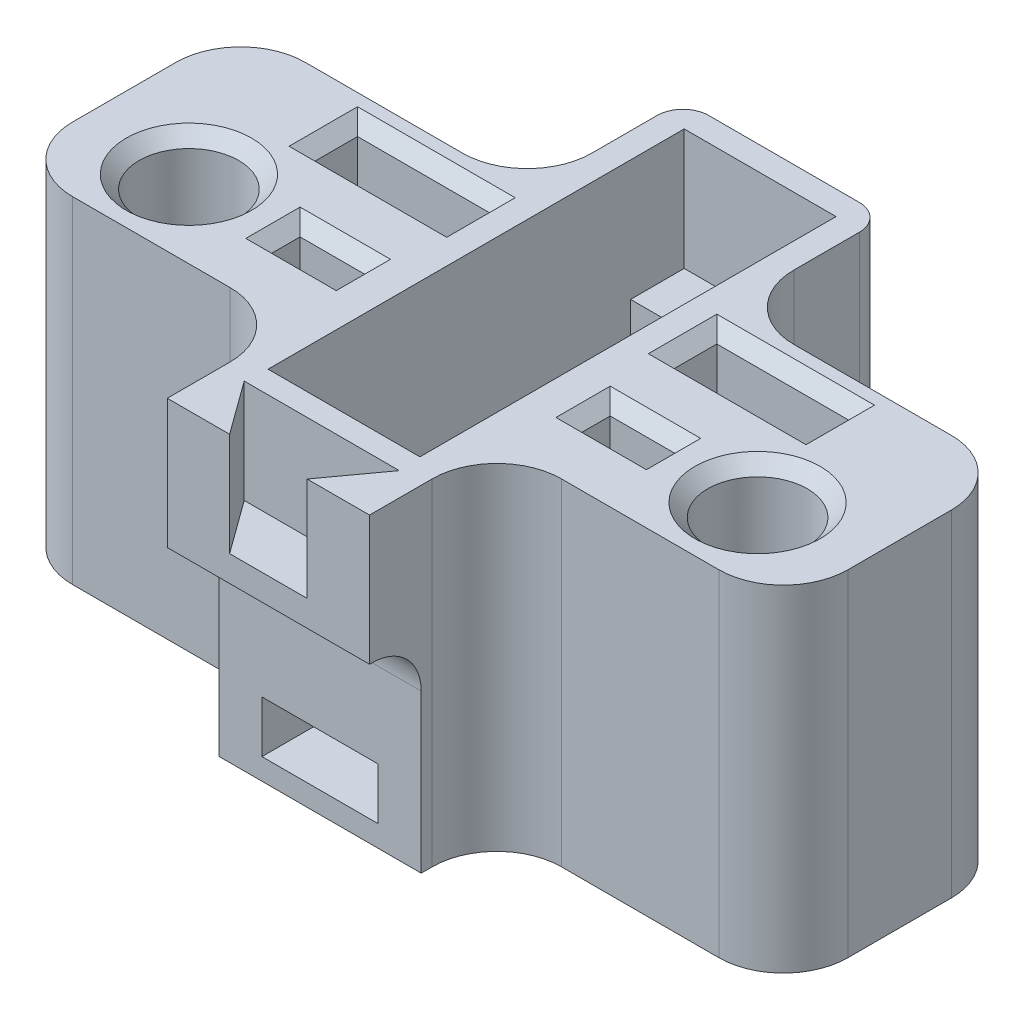
from build123d import *

# Parameters (mm, degrees)
SKETCH1_W             = 60
SKETCH1_H             = 18
BOSS_EXTRUDE1_DEPTH   = 26
SKETCH2_R             = 3.85
EYESHAFT_HOLES_DEPTH  = 15
EYESHAFT_FILLET_R     = 3
SKETCH5_W             = 5
SKETCH5_H             = 2.2
FRONT_LEG_HOLES_DEPTH = 13
SKETCH7_W             = 10.2
SKETCH7_H             = 3.3
BACK_LEGS_DEPTH       = 13
SKETCH18_W            = 15.65
SKETCH18_H            = 35.9
SERVO_BLOCK_DEPTH     = 26
SKETCH19_W            = 11.75
SKETCH19_H            = 32.2
SERVO_ARMS_DEPTH      = 9.35
SKETCH20_W            = 11.75
SKETCH20_H            = 23.9
CUT_EXTRUDE10_DEPTH   = 15
FILLET4_R             = 5
CHAMFER1_SIZE         = 1
SKETCH21_W            = 9
SKETCH21_H            = 4
CUT_EXTRUDE11_DEPTH   = 15
FILLET5_R             = 3
SKETCH22_R            = 0.75
CUT_EXTRUDE12_DEPTH   = 3
FILLET6_R             = 5
SKETCH23_W            = 15.65
SKETCH23_H            = 10
BOSS_EXTRUDE3_DEPTH   = 4
DOVE_TAIL_DEPTH       = 8
FILLET8_R             = 3.8
FILLET9_R             = 2


with BuildPart() as part:
    # Sketch1 → Boss-Extrude1 (new body)
    with BuildSketch(Plane(origin=(0, 0, 0), x_dir=(1, 0, 0), z_dir=(0, 1, 0))):
        Rectangle(SKETCH1_W, SKETCH1_H)
    extrude(amount=BOSS_EXTRUDE1_DEPTH)

    # Sketch2 → Eyeshaft holes (cut)
    with BuildSketch(Plane(origin=(0, 26, 0), x_dir=(1, 0, 0), z_dir=(0, 1, 0))):
        with Locations(Location((-22, -3, 0), (0, 0, 270))):
            Circle(SKETCH2_R)
        with Locations(Location((22, -3, 0), (0, 0, 270))):
            Circle(SKETCH2_R)
    extrude(amount=-EYESHAFT_HOLES_DEPTH, mode=Mode.SUBTRACT)

    # Eyeshaft Fillet
    eyeshaft_fillet_edges = [part.edges().sort_by_distance(p)[0] for p in [
        (-22, 11, -0.85),
        (22, 11, -0.85),
    ]]
    fillet(eyeshaft_fillet_edges, radius=EYESHAFT_FILLET_R)

    # Sketch5 → Front leg holes (cut)
    with BuildSketch(Plane(origin=(0, 26, 0), x_dir=(1, 0, 0), z_dir=(0, 1, 0))):
        with Locations((-12, -3)):
            Rectangle(SKETCH5_W, SKETCH5_H)
        with Locations((12, -3)):
            Rectangle(SKETCH5_W, SKETCH5_H)
    extrude(amount=-FRONT_LEG_HOLES_DEPTH, mode=Mode.SUBTRACT)

    # Sketch7 → Back Legs (cut)
    with BuildSketch(Plane(origin=(0, 26, 0), x_dir=(1, 0, 0), z_dir=(0, 1, 0))):
        with Locations((-13.9, 5.4)):
            Rectangle(SKETCH7_W, SKETCH7_H)
        with Locations((13.9, 5.4)):
            Rectangle(SKETCH7_W, SKETCH7_H)
    extrude(amount=-BACK_LEGS_DEPTH, mode=Mode.SUBTRACT)

    # Sketch18 → Servo Block (add)
    with BuildSketch(Plane(origin=(0, 26, 0), x_dir=(1, 0, 0), z_dir=(0, 1, 0))):
        with Locations((0, 3.1)):
            Rectangle(SKETCH18_W, SKETCH18_H)
    extrude(amount=-SERVO_BLOCK_DEPTH)

    # Sketch19 → Servo Arms (cut)
    with BuildSketch(Plane(origin=(0, 26, 0), x_dir=(1, 0, 0), z_dir=(0, 1, 0))):
        with Locations((0, 3.1)):
            Rectangle(SKETCH19_W, SKETCH19_H)
    extrude(amount=-SERVO_ARMS_DEPTH, mode=Mode.SUBTRACT)

    # Sketch20 → Cut-Extrude10 (cut)
    with BuildSketch(Plane(origin=(0, 16.65, 0), x_dir=(1, 0, 0), z_dir=(0, 1, 0))):
        with Locations((0, 3.1)):
            Rectangle(SKETCH20_W, SKETCH20_H)
    extrude(amount=-CUT_EXTRUDE10_DEPTH, mode=Mode.SUBTRACT)

    # Fillet4
    fillet4_edges = [part.edges().sort_by_distance(p)[0] for p in [
        (30, 13, 9),
        (-30, 13, 9),
        (-30, 13, -9),
        (30, 13, -9),
    ]]
    fillet(fillet4_edges, radius=FILLET4_R)

    # Chamfer1
    chamfer1_edges = [part.edges().sort_by_distance(p)[0] for p in [
        (-22, 26, -0.85),
        (22, 26, -0.85),
        (-9.5, 26, 3),
        (-12, 26, 1.9),
        (-14.5, 26, 3),
        (-12, 26, 4.1),
        (14.5, 26, 3),
        (12, 26, 1.9),
        (9.5, 26, 3),
        (12, 26, 4.1),
        (-19, 26, -5.4),
        (-13.9, 26, -3.75),
        (-8.8, 26, -5.4),
        (-13.9, 26, -7.05),
        (8.8, 26, -5.4),
        (13.9, 26, -3.75),
        (19, 26, -5.4),
        (13.9, 26, -7.05),
    ]]
    chamfer(chamfer1_edges, length=CHAMFER1_SIZE)

    # Sketch21 → Cut-Extrude11 (cut)
    with BuildSketch(Plane(origin=(0, 0, 8.85), x_dir=(-1, 0, 0), z_dir=(0, 0, -1))):
        with Locations((0, 3.65)):
            Rectangle(SKETCH21_W, SKETCH21_H)
    extrude(amount=-CUT_EXTRUDE11_DEPTH, mode=Mode.SUBTRACT)

    # Fillet5
    fillet5_edges = [part.edges().sort_by_distance(p)[0] for p in [
        (0, 5.65, 8.85),
    ]]
    fillet(fillet5_edges, radius=FILLET5_R)

    # Sketch22 → Cut-Extrude12 (cut)
    with BuildSketch(Plane(origin=(0, 16.65, 0), x_dir=(1, 0, 0), z_dir=(0, 1, 0))):
        with Locations(Location((0, 17.3, 0), (0, 0, 270))):
            Circle(SKETCH22_R)
        with Locations(Location((0, -11.1, 0), (0, 0, 270))):
            Circle(SKETCH22_R)
    extrude(amount=-CUT_EXTRUDE12_DEPTH, mode=Mode.SUBTRACT)

    # Fillet6
    fillet6_edges = [part.edges().sort_by_distance(p)[0] for p in [
        (-7.825, 13, -9),
        (-7.825, 13, 9),
        (7.825, 13, -9),
        (7.825, 13, 9),
    ]]
    fillet(fillet6_edges, radius=FILLET6_R)

    # Sketch23 → Boss-Extrude3 (add)
    with BuildSketch(Plane.XY.offset(14.85)):
        with Locations((0, 21)):
            Rectangle(SKETCH23_W, SKETCH23_H)
    extrude(amount=BOSS_EXTRUDE3_DEPTH)

    # Sketch24 → Dove tail (cut)
    with BuildSketch(Plane(origin=(0, 26, 0), x_dir=(1, 0, 0), z_dir=(0, 1, 0))):
        Polygon((6, -14.720854239), (-6, -14.720854239), (-3, -18.85), (3, -18.85), align=None)
    extrude(amount=-DOVE_TAIL_DEPTH, mode=Mode.SUBTRACT)

    # Fillet8
    fillet8_edges = [part.edges().sort_by_distance(p)[0] for p in [
        (0, 16, 14.85),
    ]]
    fillet(fillet8_edges, radius=FILLET8_R)

    # Fillet9
    fillet9_edges = [part.edges().sort_by_distance(p)[0] for p in [
        (7.825, 13, -21.05),
        (-7.825, 13, -21.05),
    ]]
    fillet(fillet9_edges, radius=FILLET9_R)


solid = part.part
